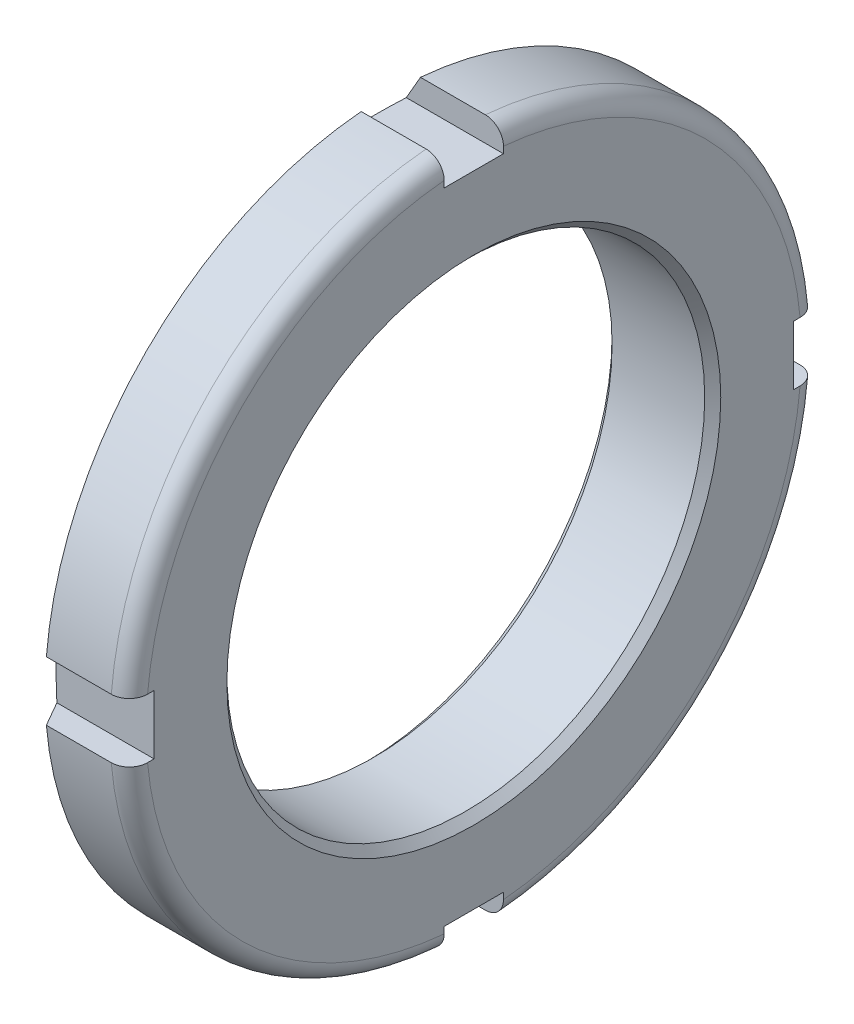
from build123d import *

# Parameters (mm, degrees)
SKETCH1_R           = 35
SKETCH1_R_2         = 24.188
BOSS_EXTRUDE1_DEPTH = 11
CHAMFER1_SIZE       = 4.5
CHAMFER1_SIZE2      = 2.598076211
CUT_EXTRUDE1_REACH  = 52.705
CUT_EXTRUDE2_REACH  = 52.705
CUT_EXTRUDE3_REACH  = 52.705
CUT_EXTRUDE4_REACH  = 52.616
CHAMFER2_SIZE       = 0.812
CHAMFER3_SIZE       = 0.812
FILLET1_R           = 1.833333333
FILLET2_R           = 1.833333333


with BuildPart() as part:
    # Sketch1 → Boss-Extrude1 (new body)
    with BuildSketch(Plane(origin=(0, 0, 0), x_dir=(0, -1, 0), z_dir=(-1, 0, 0))):
        with Locations(Location((0, 0, 0), (0, 0, 270))):
            Circle(SKETCH1_R)
        with Locations(Location((0, 0, 0), (0, 0, 270))):
            Circle(SKETCH1_R_2, mode=Mode.SUBTRACT)
    extrude(amount=-BOSS_EXTRUDE1_DEPTH)

    # Chamfer1
    chamfer1_edges = [part.edges().sort_by_distance(p)[0] for p in [
        (0, 0, 35),
    ]]
    chamfer1_side = [part.faces().sort_by_distance(p)[0] for p in [
        (0, 0, 34.010050506),
    ]]
    chamfer(chamfer1_edges, length=CHAMFER1_SIZE, length2=CHAMFER1_SIZE2, reference=chamfer1_side[0])

    # Cut-Extrude1: up to this cone (the profile starts inside it)
    cut_extrude1_end = Plane(origin=(11, 0, 0), z_dir=(1, 0, 0)).offset(-28.60918221) * Cone(1.732e-06, 227.533871731, 131.366741094, align=(Align.CENTER, Align.CENTER, Align.MIN), mode=Mode.PRIVATE)
    # Sketch2 → Cut-Extrude1 (cut, up to the surface)
    with BuildSketch(Plane(origin=(11, 0, 0), x_dir=(0, 0, -1), z_dir=(1, 0, 0)), mode=Mode.PRIVATE) as cut_extrude1_sk1:
        with BuildLine():
            Line((34.871191548, 3), (32.371191548, 3))
            Line((32.371191548, 3), (32.371191548, -3))
            Line((32.371191548, -3), (34.871191548, -3))
            ThreePointArc((34.871191548, -3), (35, 0), (34.871191548, 3))
        make_face()
    cut_extrude1_tool1 = extrude(cut_extrude1_sk1.sketch, amount=-CUT_EXTRUDE1_REACH, mode=Mode.PRIVATE) & cut_extrude1_end
    add(cut_extrude1_tool1.solids().sort_by_distance((11, 0, -33.664429))[0], mode=Mode.SUBTRACT)

    # Cut-Extrude2: up to this cone (the profile starts inside it)
    cut_extrude2_end = Plane(origin=(11, 0, 0), z_dir=(1, 0, 0)).offset(-28.60918221) * Cone(1.732e-06, 227.533871731, 131.366741094, align=(Align.CENTER, Align.CENTER, Align.MIN), mode=Mode.PRIVATE)
    # Sketch3 → Cut-Extrude2 (cut, up to the surface)
    with BuildSketch(Plane(origin=(11, 0, 0), x_dir=(0, 0, -1), z_dir=(1, 0, 0)), mode=Mode.PRIVATE) as cut_extrude2_sk1:
        with BuildLine():
            Line((3, -34.871191548), (3, -32.371191548))
            Line((3, -32.371191548), (-3, -32.371191548))
            Line((-3, -32.371191548), (-3, -34.871191548))
            ThreePointArc((-3, -34.871191548), (0, -35), (3, -34.871191548))
        make_face()
    cut_extrude2_tool1 = extrude(cut_extrude2_sk1.sketch, amount=-CUT_EXTRUDE2_REACH, mode=Mode.PRIVATE) & cut_extrude2_end
    add(cut_extrude2_tool1.solids().sort_by_distance((11, -33.664429, 0))[0], mode=Mode.SUBTRACT)

    # Cut-Extrude3: up to this cone (the profile starts inside it)
    cut_extrude3_end = Plane(origin=(11, 0, 0), z_dir=(1, 0, 0)).offset(-28.60918221) * Cone(1.732e-06, 227.533871731, 131.366741094, align=(Align.CENTER, Align.CENTER, Align.MIN), mode=Mode.PRIVATE)
    # Sketch4 → Cut-Extrude3 (cut, up to the surface)
    with BuildSketch(Plane(origin=(11, 0, 0), x_dir=(0, 0, -1), z_dir=(1, 0, 0)), mode=Mode.PRIVATE) as cut_extrude3_sk1:
        with BuildLine():
            Line((-34.871191548, -3), (-32.371191548, -3))
            Line((-32.371191548, -3), (-32.371191548, 3))
            Line((-32.371191548, 3), (-34.871191548, 3))
            ThreePointArc((-34.871191548, 3), (-35, 0), (-34.871191548, -3))
        make_face()
    cut_extrude3_tool1 = extrude(cut_extrude3_sk1.sketch, amount=-CUT_EXTRUDE3_REACH, mode=Mode.PRIVATE) & cut_extrude3_end
    add(cut_extrude3_tool1.solids().sort_by_distance((11, 0, 33.664429))[0], mode=Mode.SUBTRACT)

    # Cut-Extrude4: up to this cone (the profile starts inside it)
    cut_extrude4_end = Plane(origin=(11, 0, 0), z_dir=(1, 0, 0)).offset(-28.60918221) * Cone(1.732e-06, 227.379719209, 131.277741094, align=(Align.CENTER, Align.CENTER, Align.MIN), mode=Mode.PRIVATE)
    # Sketch5 → Cut-Extrude4 (cut, up to the surface)
    with BuildSketch(Plane(origin=(11, 0, 0), x_dir=(0, 0, -1), z_dir=(1, 0, 0)), mode=Mode.PRIVATE) as cut_extrude4_sk1:
        with BuildLine():
            Line((-3, 34.871191548), (-3, 32.371191548))
            Line((-3, 32.371191548), (3, 32.371191548))
            Line((3, 32.371191548), (3, 34.871191548))
            ThreePointArc((3, 34.871191548), (0, 35), (-3, 34.871191548))
        make_face()
    cut_extrude4_tool1 = extrude(cut_extrude4_sk1.sketch, amount=-CUT_EXTRUDE4_REACH, mode=Mode.PRIVATE) & cut_extrude4_end
    add(cut_extrude4_tool1.solids().sort_by_distance((11, 33.664429, 0))[0], mode=Mode.SUBTRACT)

    # Chamfer2
    chamfer2_edges = [part.edges().sort_by_distance(p)[0] for p in [
        (0, 0, 24.188),
    ]]
    chamfer(chamfer2_edges, length=CHAMFER2_SIZE)

    # Chamfer3
    chamfer3_edges = [part.edges().sort_by_distance(p)[0] for p in [
        (11, 0, 24.188),
    ]]
    chamfer(chamfer3_edges, length=CHAMFER3_SIZE)

    # Fillet1
    fillet1_edges = [part.edges().sort_by_distance(p)[0] for p in [
        (11, -24.748737342, 24.748737342),
        (11, 24.748737342, 24.748737342),
        (11, -24.748737342, -24.748737342),
    ]]
    fillet(fillet1_edges, radius=FILLET1_R)

    # Fillet2
    fillet2_edges = [part.edges().sort_by_distance(p)[0] for p in [
        (11, 24.748737342, -24.748737342),
    ]]
    fillet(fillet2_edges, radius=FILLET2_R)


solid = part.part
